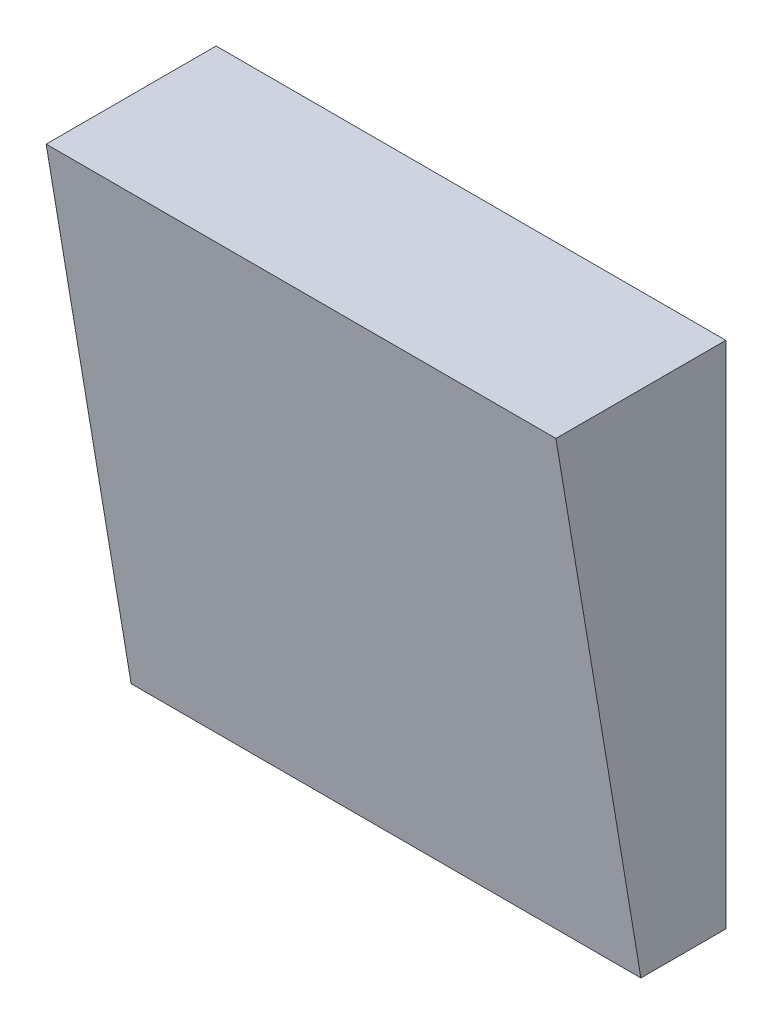
from build123d import *

# Parameters (mm, degrees)
SKETCH1_W                = 40
SKETCH1_H                = 40
BOSS_EXTRUDE1_DEPTH      = 20
SURFACE_EXTRUDE1_1_BACK  = 50
SURFACE_EXTRUDE1_1_DEPTH = 100


with BuildPart() as part:
    # Sketch1 → Boss-Extrude1 (new body)
    with BuildSketch(Plane.XY):
        with Locations((20, 20)):
            Rectangle(SKETCH1_W, SKETCH1_H)
    extrude(amount=BOSS_EXTRUDE1_DEPTH)

    # SurfaceCut1: cut with a surface, the side behind it stays
    # Surface-Extrude1: a surface, the sketch's curves swept straight by 100 mm
    with BuildLine(Plane(origin=(0, 0, 0), x_dir=(0, 0, -1), z_dir=(1, 0, 0)).offset(-SURFACE_EXTRUDE1_1_BACK), mode=Mode.PRIVATE) as surface_extrude1_1_path:
        Line((-5, -10), (-15, 50))
    surface_extrude1_1 = Shell.extrude(surface_extrude1_1_path.wire(), (1 * SURFACE_EXTRUDE1_1_DEPTH, 0 * SURFACE_EXTRUDE1_1_DEPTH, 0 * SURFACE_EXTRUDE1_1_DEPTH))
    split(bisect_by=surface_extrude1_1, keep=Keep.BOTTOM)


solid = part.part
